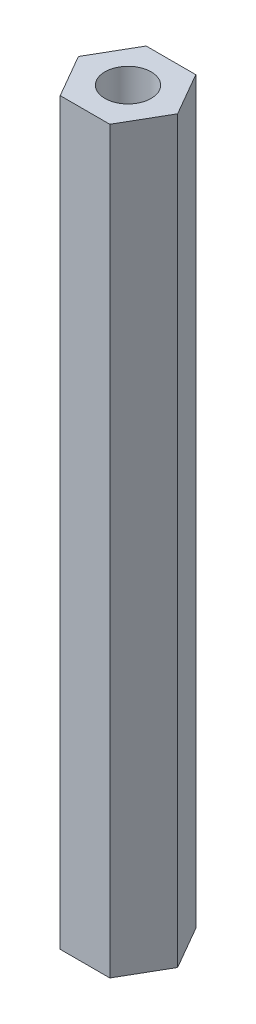
from build123d import *

# Parameters (mm, degrees)
EXTRUDE_1_DEPTH = 20


with BuildPart() as part:
    # 草图1 → 凸台-拉伸1 (new, symmetric)
    with BuildSketch(Plane(origin=(0, 0, 0), x_dir=(1, 0, 0), z_dir=(0, 1, 0))):
        Polygon((2.684678752, 0), (1.342339376, 2.325), (-1.342339376, 2.325), (-2.684678752, 0), (-1.342339376, -2.325), (1.342339376, -2.325), align=None)
    extrude(amount=EXTRUDE_1_DEPTH, both=True)

    # 草图2 → M3 螺纹孔1 (revolve, cut)
    with BuildSketch(Plane(origin=(0, -20, 0), x_dir=(0, 0, -1), z_dir=(1, 0, 0))):
        Polygon((0, 0), (0, 8.251075774), (1.25, 7.5), (1.25, 0), align=None)
    hole_wizard_m3_1 = revolve(axis=Axis((0, -26.35, 0), (0, 1, 0)), mode=Mode.SUBTRACT)

    # 镜向1: M3 螺纹孔1 across plane
    add(hole_wizard_m3_1.mirror(Plane.ZX), mode=Mode.SUBTRACT)


solid = part.part
